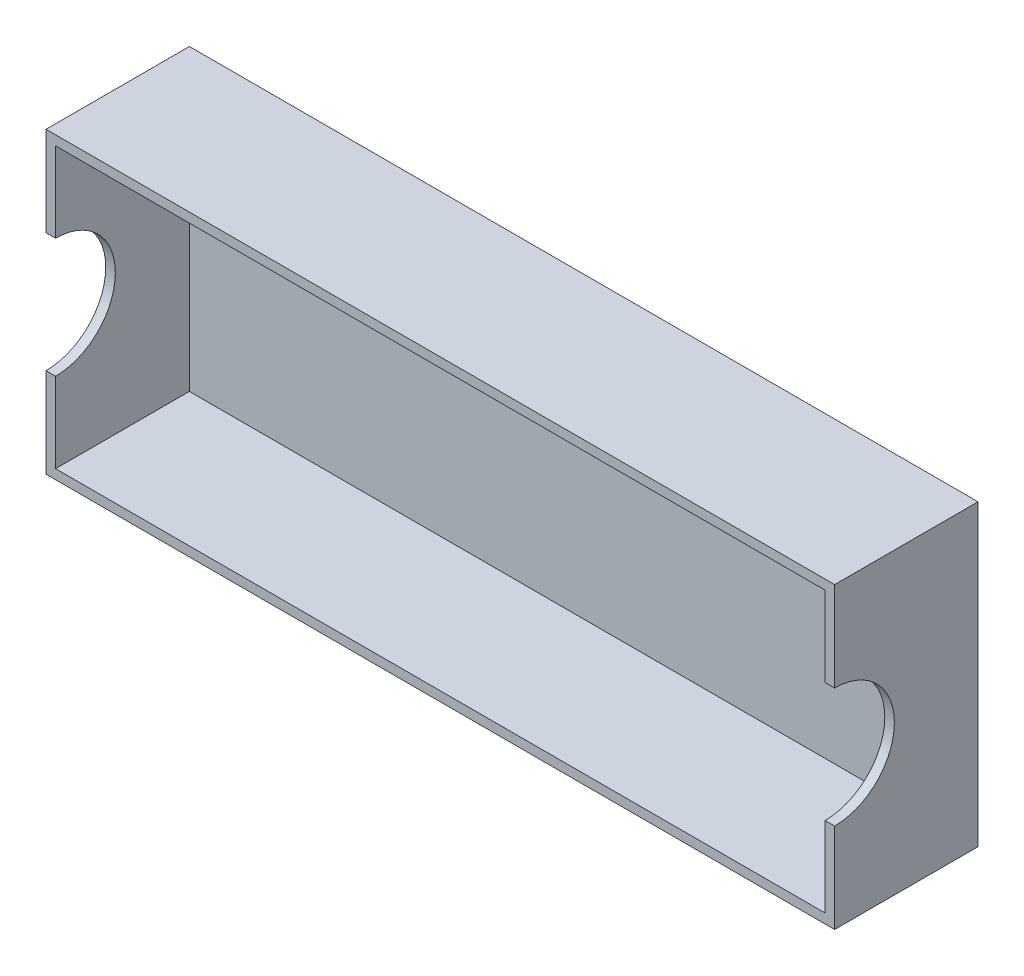
from build123d import *

# Parameters (mm, degrees)
SKETCH2_W           = 66
SKETCH2_H           = 25
BOSS_EXTRUDE1_DEPTH = 12
SKETCH3_W           = 64.4
SKETCH3_H           = 23.4
CUT_EXTRUDE1_DEPTH  = 11.2
SKETCH5_R           = 5
CUT_EXTRUDE2_DEPTH  = 69.23672032


with BuildPart() as part:
    # Sketch2 → Boss-Extrude1 (new body)
    with BuildSketch(Plane.XY):
        Rectangle(SKETCH2_W, SKETCH2_H)
    extrude(amount=BOSS_EXTRUDE1_DEPTH)

    # Sketch3 → Cut-Extrude1 (cut)
    with BuildSketch(Plane.XY.offset(12)):
        Rectangle(SKETCH3_W, SKETCH3_H)
    extrude(amount=-CUT_EXTRUDE1_DEPTH, mode=Mode.SUBTRACT)

    # Sketch5 → Cut-Extrude2 (cut, through all)
    with BuildSketch(Plane(origin=(33, 0, 0), x_dir=(0, 0, -1), z_dir=(1, 0, 0))):
        with Locations((-12, 0)):
            Circle(SKETCH5_R)
    extrude(amount=-CUT_EXTRUDE2_DEPTH, mode=Mode.SUBTRACT)


solid = part.part
